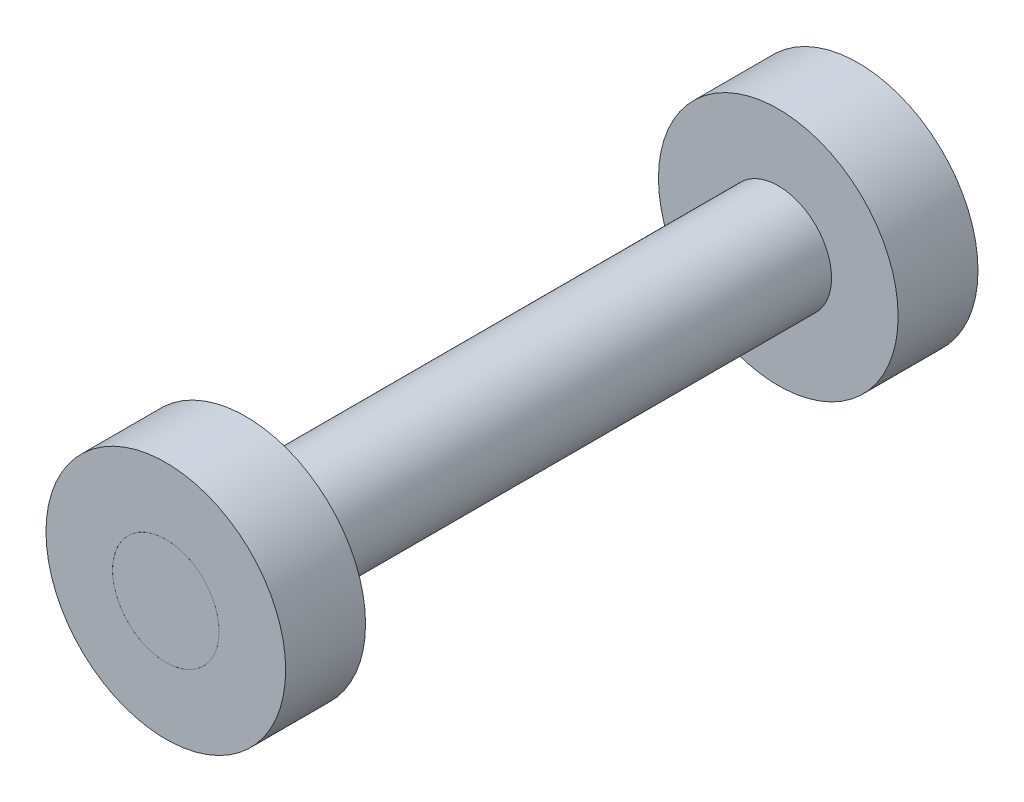
from build123d import *

# Parameters (mm, degrees)
CROQUIS1_R              = 4.5
SALIENTE_EXTRUIR1_DEPTH = 3
CROQUIS2_R              = 2
SALIENTE_EXTRUIR2_DEPTH = 26
SALIENTE_EXTRUIR3_START = 23
CROQUIS4_R              = 4.5
CROQUIS4_R_2            = 2
SALIENTE_EXTRUIR3_DEPTH = 3


with BuildPart() as part:
    # Croquis1 → Saliente-Extruir1 (new body)
    with BuildSketch(Plane.XY):
        Circle(CROQUIS1_R)
    extrude(amount=SALIENTE_EXTRUIR1_DEPTH)

    # Croquis2 → Saliente-Extruir2 (add)
    with BuildSketch(Plane.XY):
        with Locations(Location((0, 0, 0), (0, 0, 180))):
            Circle(CROQUIS2_R)
    extrude(amount=SALIENTE_EXTRUIR2_DEPTH)


with BuildPart() as body_2:
    # Croquis4 → Saliente-Extruir3 (new body)
    with BuildSketch(Plane.XY.offset(SALIENTE_EXTRUIR3_START)):
        Circle(CROQUIS4_R)
        Circle(CROQUIS4_R_2, mode=Mode.SUBTRACT)
    extrude(amount=SALIENTE_EXTRUIR3_DEPTH)


solid = Compound([part.part, body_2.part])
